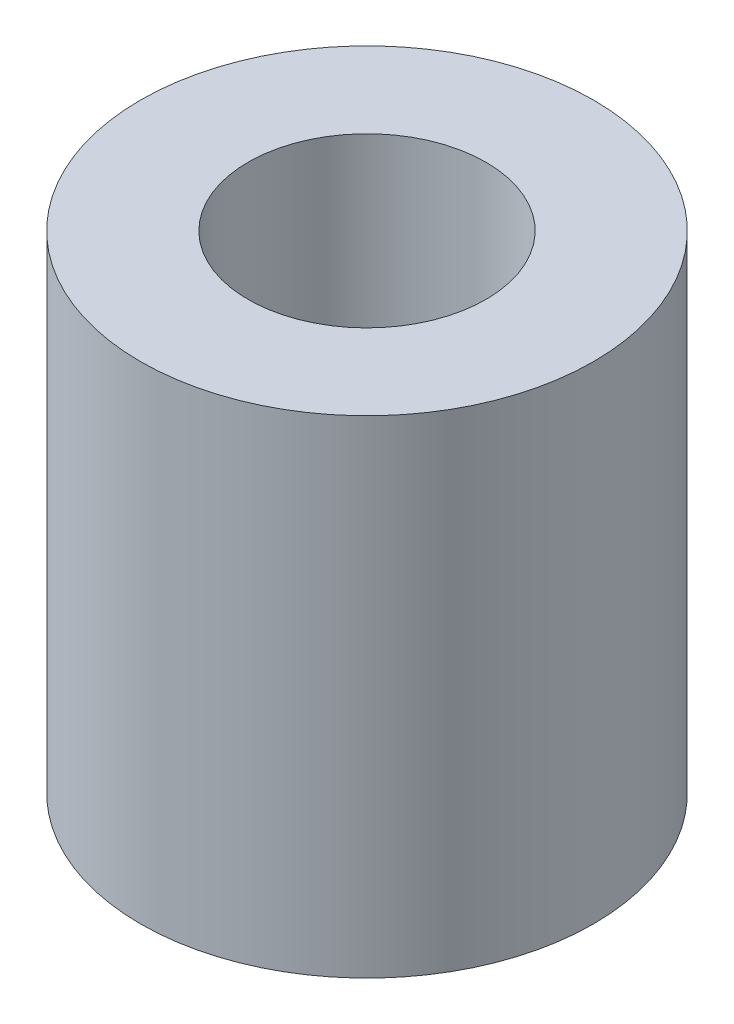
from build123d import *

# Parameters (mm, degrees)
SKETCH1_R           = 4
SKETCH1_R_2         = 2.1
BOSS_EXTRUDE1_DEPTH = 8.6


with BuildPart() as part:
    # Sketch1 → Boss-Extrude1 (new body)
    with BuildSketch(Plane(origin=(0, 0, 0), x_dir=(1, 0, 0), z_dir=(0, 1, 0))):
        with Locations(Location((0, 0, 0), (0, 0, 90))):
            Circle(SKETCH1_R)
        with Locations(Location((0, 0, 0), (0, 0, 90))):
            Circle(SKETCH1_R_2, mode=Mode.SUBTRACT)
    extrude(amount=BOSS_EXTRUDE1_DEPTH)


solid = part.part
